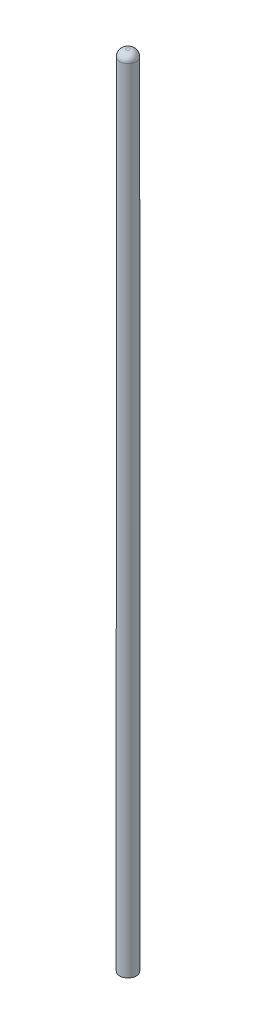
from build123d import *

# Parameters (mm, degrees)
SKETCH1_R           = 1.5875
BOSS_EXTRUDE1_DEPTH = 152.4
FILLET2_R           = 1.27


with BuildPart() as part:
    # Sketch1 → Boss-Extrude1 (new body)
    with BuildSketch(Plane(origin=(0, 0, 0), x_dir=(1, 0, 0), z_dir=(0, 1, 0))):
        with Locations(Location((0, 0, 0), (0, 0, 90))):
            Circle(SKETCH1_R)
    extrude(amount=BOSS_EXTRUDE1_DEPTH)

    # Fillet2
    fillet2_edges = [part.edges().sort_by_distance(p)[0] for p in [
        (0, 152.4, 1.5875),
    ]]
    fillet(fillet2_edges, radius=FILLET2_R)


solid = part.part
